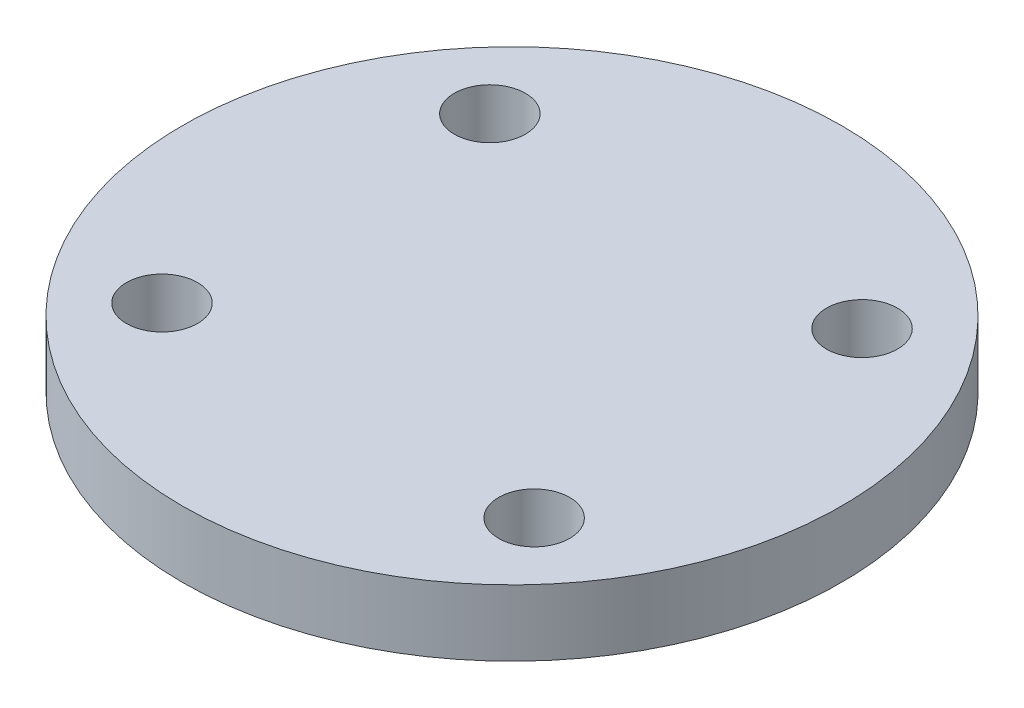
from build123d import *

# Parameters (mm, degrees)
SKETCH1_R           = 19.933279246
SKETCH1_R_2         = 2.15
BOSS_EXTRUDE1_DEPTH = 4


with BuildPart() as part:
    # Sketch1 → Boss-Extrude1 (new body)
    with BuildSketch(Plane(origin=(0, 0, 0), x_dir=(1, 0, 0), z_dir=(0, 1, 0))):
        with Locations(Location((0, 0, 0), (0, 0, 270))):
            Circle(SKETCH1_R)
        with Locations(Location((11.255384923, 9.915458146, 0), (0, 0, 270))):
            Circle(SKETCH1_R_2, mode=Mode.SUBTRACT)
        with Locations(Location((11.255384923, -9.915458146, 0), (0, 0, 270))):
            Circle(SKETCH1_R_2, mode=Mode.SUBTRACT)
        with Locations(Location((-11.255384923, -9.915458146, 0), (0, 0, 270))):
            Circle(SKETCH1_R_2, mode=Mode.SUBTRACT)
        with Locations(Location((-11.255384923, 9.915458146, 0), (0, 0, 270))):
            Circle(SKETCH1_R_2, mode=Mode.SUBTRACT)
    extrude(amount=BOSS_EXTRUDE1_DEPTH)


solid = part.part
